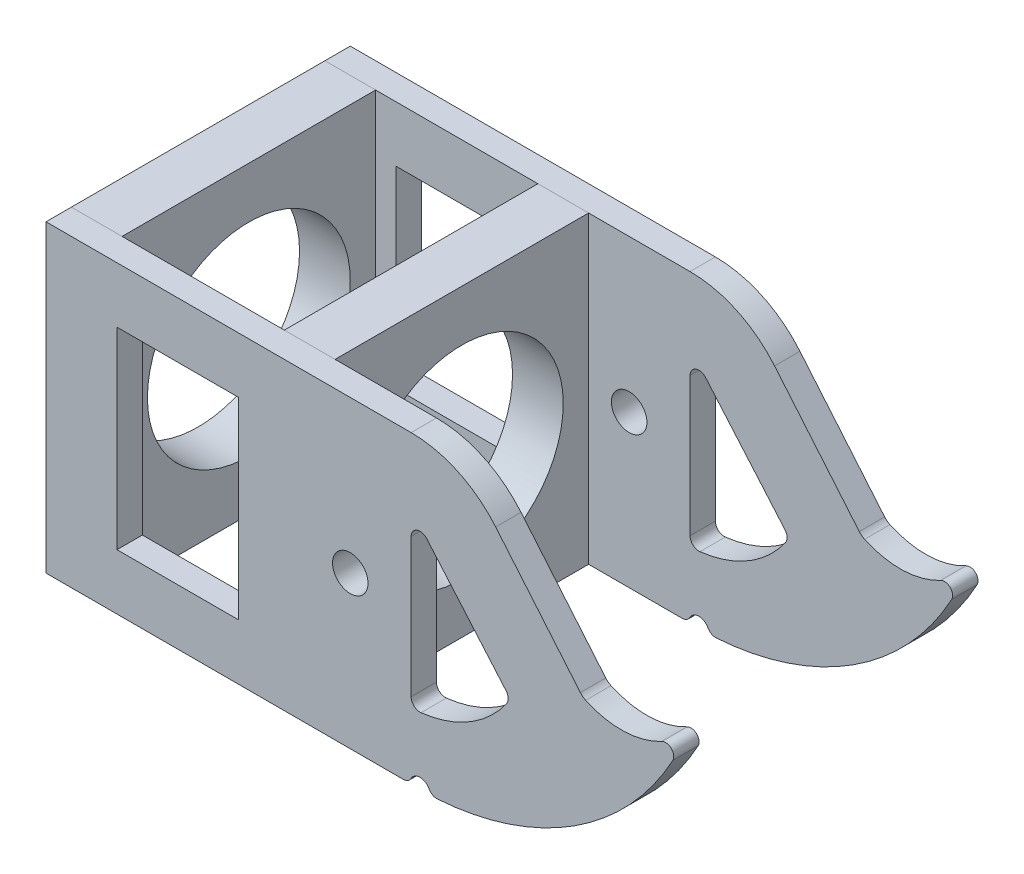
from build123d import *

# Parameters (mm, degrees)
SKETCH1_W               = 12
SKETCH1_H               = 19
BOSS_EXTRUDE1_DEPTH     = 2.5
SKETCH2_W               = 5
SKETCH2_H               = 30
BOSS_EXTRUDE2_DEPTH     = 25
BOSS_EXTRUDE2_2_DEPTH   = 25
CUT_EXTRUDE1_START      = -26
SKETCH3_R               = 10
CUT_EXTRUDE1_DEPTH      = 26
CUT_EXTRUDE2_DEPTH      = 39.305093566
CUT_EXTRUDE2_DEPTH_BACK = 39.305093566
SKETCH4_R               = 1.75


with BuildPart() as part:
    # Sketch1 → Boss-Extrude1 (new body)
    with BuildSketch(Plane.XY):
        with BuildLine():
            Line((5.218675227, -15), (-30, -15))
            Line((-30, -15), (-30, 15))
            Line((-30, 15), (6, 15))
            ThreePointArc((6, 15), (10.601443669, 13.979062641), (14.339323781, 11.107852236))
            Line((14.339323781, 11.107852236), (22.688779578, 1.143586689))
            ThreePointArc((22.688779578, 1.143586689), (22.927337997, 0.915440554), (23.210021393, 0.744997378))
            ThreePointArc((23.210021393, 0.744997378), (26.990294912, -0.022324307), (30.714135867, 0.983786514))
            ThreePointArc((30.714135867, 0.983786514), (31.661011891, 0.845361822), (31.797774266, -0.101755727))
            ThreePointArc((31.797774266, -0.101755727), (22.084906112, -10.540786811), (8.541324773, -15))
            ThreePointArc((8.541324773, -15), (8.087499424, -14.873951294), (7.76368339, -14.531914894))
            ThreePointArc((7.76368339, -14.531914894), (6.88, -14), (5.99631661, -14.531914894))
            ThreePointArc((5.99631661, -14.531914894), (5.672500576, -14.873951294), (5.218675227, -15))
        make_face()
        with Locations((-17, 0)):
            Rectangle(SKETCH1_W, SKETCH1_H, mode=Mode.SUBTRACT)
        with BuildLine():
            Line((6, 6.130536766), (6, -7.555592076))
            ThreePointArc((6, -7.555592076), (6.293680971, -8.211816121), (6.978704537, -8.430038996))
            ThreePointArc((6.978704537, -8.430038996), (11.728100272, -6.838146724), (15.40876192, -3.440557773))
            ThreePointArc((15.40876192, -3.440557773), (15.568644863, -2.890698084), (15.356341606, -2.358875218))
            Line((15.356341606, -2.358875218), (7.546665198, 6.70495605))
            ThreePointArc((7.546665198, 6.70495605), (6.573622271, 6.955480817), (6, 6.130536766))
        make_face(mode=Mode.SUBTRACT)
    extrude(amount=BOSS_EXTRUDE1_DEPTH)


with BuildPart() as body_2:
    # Sketch2 → Boss-Extrude2 (new body)
    with BuildSketch(Plane.XY.offset(2.5)):
        with Locations((-27.5, 0)):
            Rectangle(SKETCH2_W, SKETCH2_H)
    extrude(amount=BOSS_EXTRUDE2_DEPTH)


with BuildPart() as body_3:
    # Sketch2 → Boss-Extrude2 2 (new body)
    with BuildSketch(Plane.XY.offset(2.5)):
        with Locations((-6.5, 0)):
            Rectangle(SKETCH2_W, SKETCH2_H)
    extrude(amount=BOSS_EXTRUDE2_2_DEPTH)


with BuildPart() as body_4:
    # Mirror3: mirrored copy
    add(part.part.mirror(Plane.XY.offset(15)))


with BuildPart() as cut_extrude1_tool:
    # Sketch3 → Cut-Extrude1 (new body)
    with BuildSketch(Plane.ZY.offset(30).offset(CUT_EXTRUDE1_START)):
        with Locations((15, -0.026566761)):
            Circle(SKETCH3_R)
    extrude(amount=CUT_EXTRUDE1_DEPTH)


with BuildPart() as body_2_1:
    add(body_2.part)

    # Cut-Extrude1: cut by cut_extrude1_tool
    add(cut_extrude1_tool.part, mode=Mode.SUBTRACT)


with BuildPart() as body_3_1:
    add(body_3.part)

    # Cut-Extrude1: cut by cut_extrude1_tool
    add(cut_extrude1_tool.part, mode=Mode.SUBTRACT)


with BuildPart() as cut_extrude2_tool:
    # Sketch4 → Cut-Extrude2 (new, two sides: drawn at the far end of the back side and taken through both)
    with BuildSketch(Plane.XY.offset(15).offset(-CUT_EXTRUDE2_DEPTH_BACK)):
        Circle(SKETCH4_R)
    extrude(amount=CUT_EXTRUDE2_DEPTH + CUT_EXTRUDE2_DEPTH_BACK)


with BuildPart() as part_1:
    add(part.part)

    # Cut-Extrude2: cut by cut_extrude2_tool
    add(cut_extrude2_tool.part, mode=Mode.SUBTRACT)


with BuildPart() as body_4_1:
    add(body_4.part)

    # Cut-Extrude2: cut by cut_extrude2_tool
    add(cut_extrude2_tool.part, mode=Mode.SUBTRACT)


solid = Compound([body_2_1.part, body_3_1.part, part_1.part, body_4_1.part])
